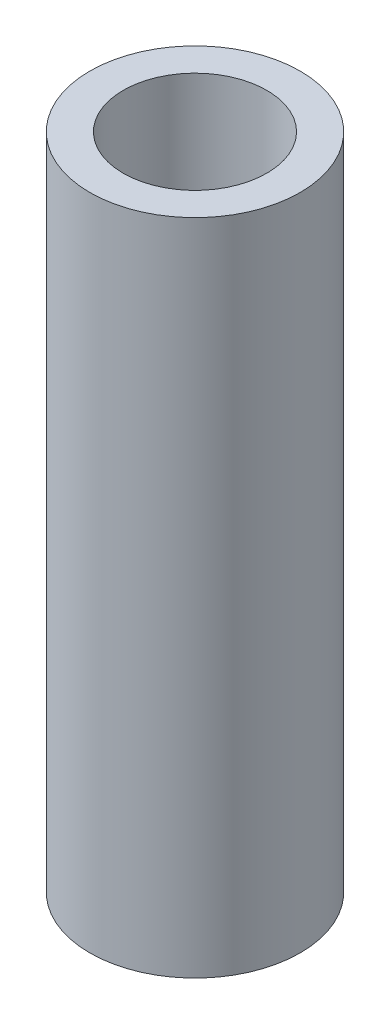
from build123d import *

# Parameters (mm, degrees)
SKETCH1_R           = 31.53
SKETCH1_R_2         = 21.53
BOSS_EXTRUDE1_DEPTH = 197.41
SKETCH2_R           = 11.53
CUT_EXTRUDE1_DEPTH  = 203.383274754


with BuildPart() as part:
    # Sketch1 → Boss-Extrude1 (new body)
    with BuildSketch(Plane(origin=(0, 0, 0), x_dir=(1, 0, 0), z_dir=(0, 1, 0))):
        with Locations(Location((0, 0, 0), (0, 0, 270))):
            Circle(SKETCH1_R)
        with Locations(Location((0, 0, 0), (0, 0, 270))):
            Circle(SKETCH1_R_2, mode=Mode.SUBTRACT)
    extrude(amount=BOSS_EXTRUDE1_DEPTH)

    # Sketch2 → Cut-Extrude1 (cut, through all)
    with BuildSketch(Plane(origin=(0, 0, 0), x_dir=(0, 0, -1), z_dir=(1, 0, 0))):
        with Locations((0, 132.71)):
            Circle(SKETCH2_R)
        with Locations((0, 81.41)):
            Circle(SKETCH2_R)
        with Locations((0, 30.11)):
            Circle(SKETCH2_R)
    extrude(amount=-CUT_EXTRUDE1_DEPTH, mode=Mode.SUBTRACT)


solid = part.part
